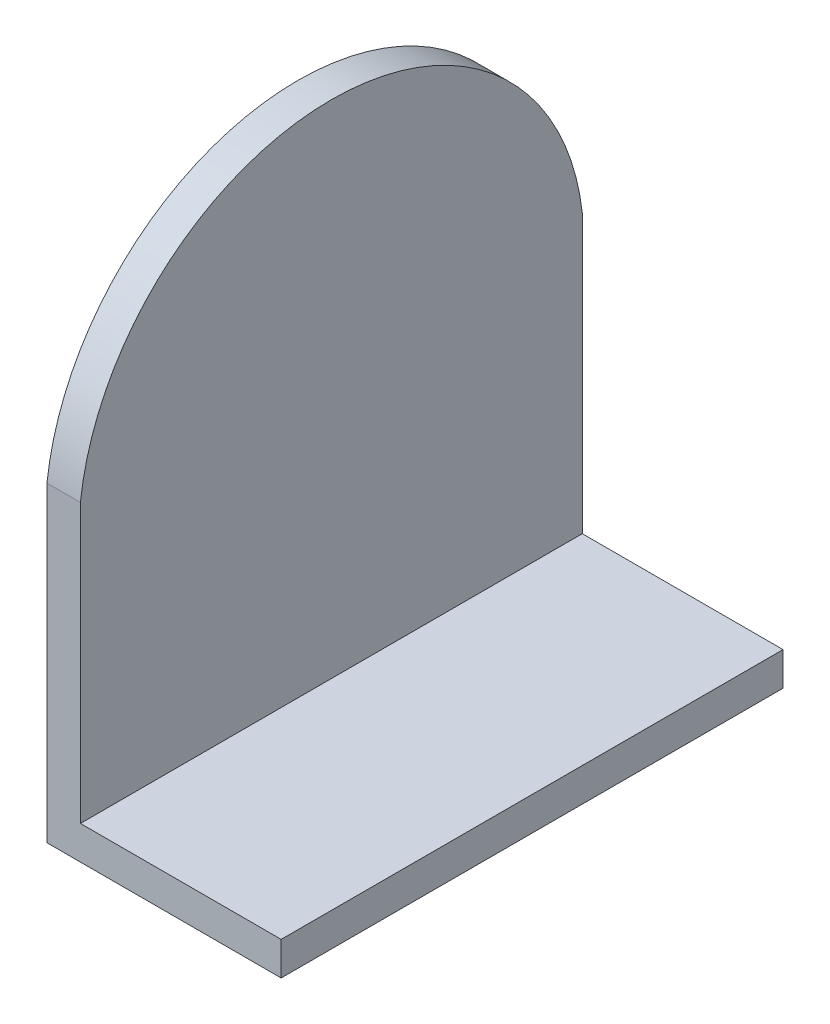
from build123d import *

# Parameters (mm, degrees)
EXTRUDE_1_DEPTH     = 30
CUT_EXTRUDE_1_DEPTH = 45.676615807


with BuildPart() as part:
    # Эскиз1 → Вытянуть-Тонкостенный1 (new body)
    with BuildSketch(Plane.XY):
        Polygon((12, 0), (0, 0), (0, 30), (-2, 30), (-2, -2), (12, -2), align=None)
    extrude(amount=EXTRUDE_1_DEPTH)

    # Эскиз2 → Вытянуть1 (cut, through all)
    with BuildSketch(Plane.ZY.offset(2)):
        with BuildLine():
            Line((-0.098661396, 15.181132745), (-3.6788427, 15.181132745))
            Line((-3.6788427, 15.181132745), (-3.6788427, 31.57095784))
            Line((-3.6788427, 31.57095784), (33.600371965, 31.57095784))
            Line((33.600371965, 31.57095784), (33.600371965, 15.181132745))
            Line((33.600371965, 15.181132745), (30.098661396, 15.181132745))
            ThreePointArc((30.098661396, 15.181132745), (15, 29.966627674), (-0.098661396, 15.181132745))
        make_face()
    extrude(amount=-CUT_EXTRUDE_1_DEPTH, mode=Mode.SUBTRACT)


solid = part.part
